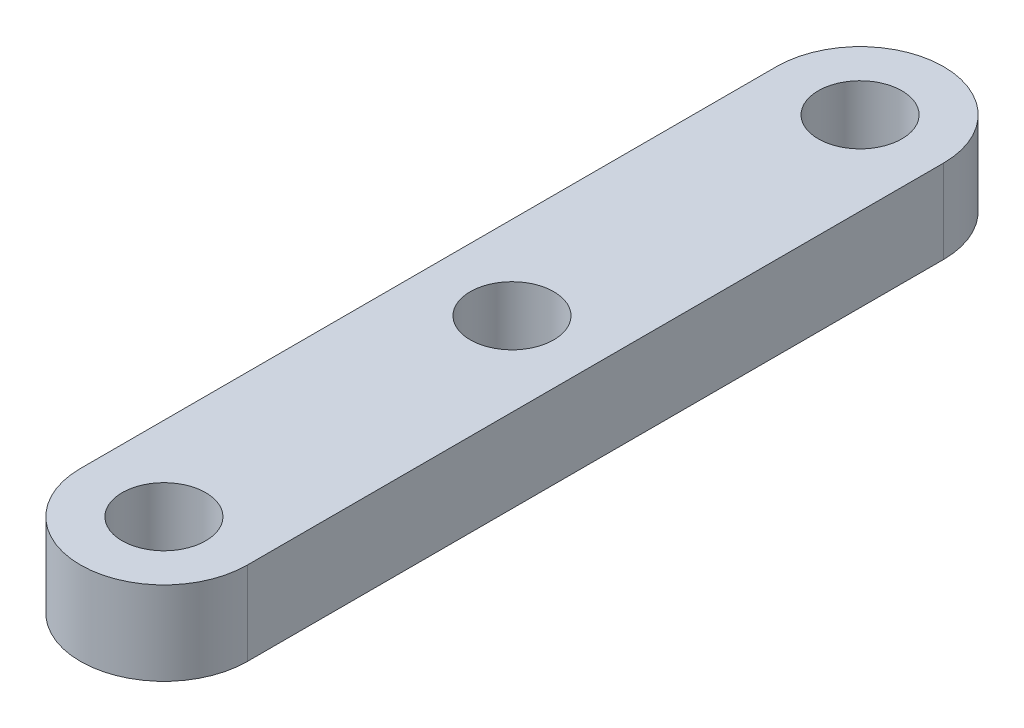
from build123d import *

# Parameters (mm, degrees)
SKETCH3_R           = 1.5
BOSS_EXTRUDE1_DEPTH = 3


with BuildPart() as part:
    # Sketch3 → Boss-Extrude1 (new body)
    with BuildSketch(Plane(origin=(0, 0, 0), x_dir=(1, 0, 0), z_dir=(0, 1, 0))):
        with BuildLine():
            Line((-3, 12.5), (-3, -12.5))
            ThreePointArc((-3, -12.5), (0, -15.5), (3, -12.5))
            Line((3, -12.5), (3, 12.5))
            ThreePointArc((3, 12.5), (0, 15.5), (-3, 12.5))
        make_face()
        with Locations(Location((0, 12.5, 0), (0, 0, 270))):
            Circle(SKETCH3_R, mode=Mode.SUBTRACT)
        with Locations(Location((0, 0, 0), (0, 0, 270))):
            Circle(SKETCH3_R, mode=Mode.SUBTRACT)
        with Locations(Location((0, -12.5, 0), (0, 0, 270))):
            Circle(SKETCH3_R, mode=Mode.SUBTRACT)
    extrude(amount=BOSS_EXTRUDE1_DEPTH)


solid = part.part
